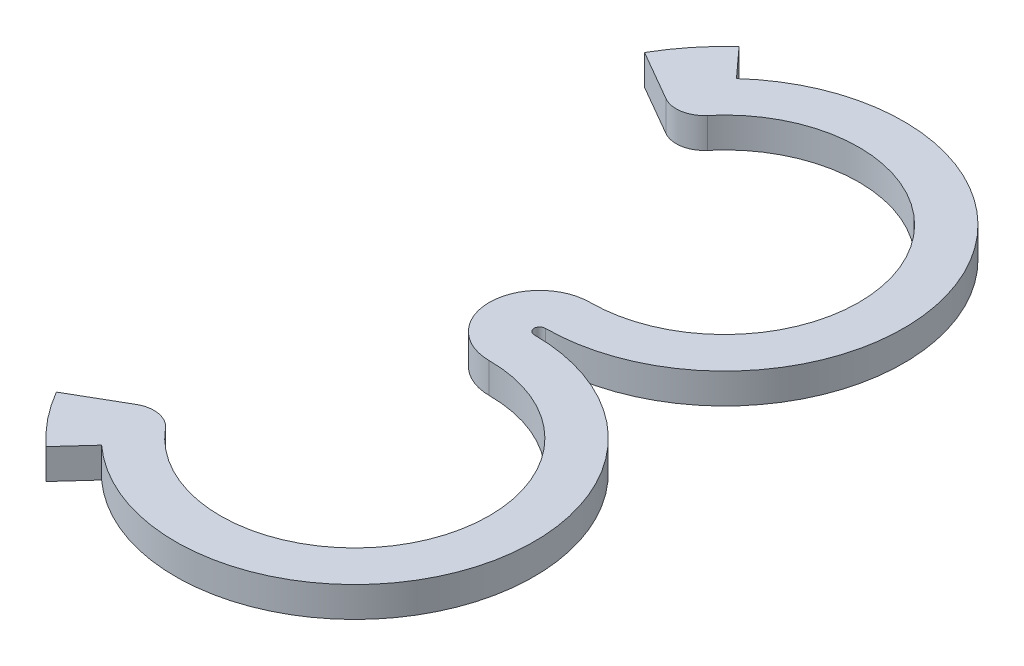
from build123d import *

# Parameters (mm, degrees)
EXTRUDE_1_DEPTH = 2.7


with BuildPart() as part:
    # 草图1 → 凸台-拉伸1 (new body)
    with BuildSketch(Plane(origin=(0, 0, 0), x_dir=(1, 0, 0), z_dir=(0, 1, 0))):
        with BuildLine():
            Line((-12.369316877, 7.141428429), (-16.887495374, 9.75))
            ThreePointArc((-16.887495374, 9.75), (-15.186446596, 12.232000645), (-13.123802868, 14.422752799))
            Line((-13.123802868, 14.422752799), (-10.768248507, 11.834053578))
            ThreePointArc((-10.768248507, 11.834053578), (14.922212592, 5.77300367), (0, -16))
            ThreePointArc((0, -16), (-0.5, -16.5), (0, -17))
            ThreePointArc((0, -17), (14.922212592, -38.77300367), (-10.768248507, -44.834053578))
            Line((-10.768248507, -44.834053578), (-13.123802868, -47.422752799))
            ThreePointArc((-13.123802868, -47.422752799), (-15.186446596, -45.232000645), (-16.887495374, -42.75))
            Line((-16.887495374, -42.75), (-12.369316877, -40.141428429))
            ThreePointArc((-12.369316877, -40.141428429), (-10.683653707, -39.844745078), (-9.202193277, -40.701924362))
            ThreePointArc((-9.202193277, -40.701924362), (10.872513333, -38.078233337), (0, -21))
            ThreePointArc((0, -21), (-4.5, -16.5), (0, -12))
            ThreePointArc((0, -12), (10.872513333, 5.078233337), (-9.202193277, 7.701924362))
            ThreePointArc((-9.202193277, 7.701924362), (-10.683653707, 6.844745078), (-12.369316877, 7.141428429))
        make_face()
    extrude(amount=EXTRUDE_1_DEPTH)


solid = part.part
